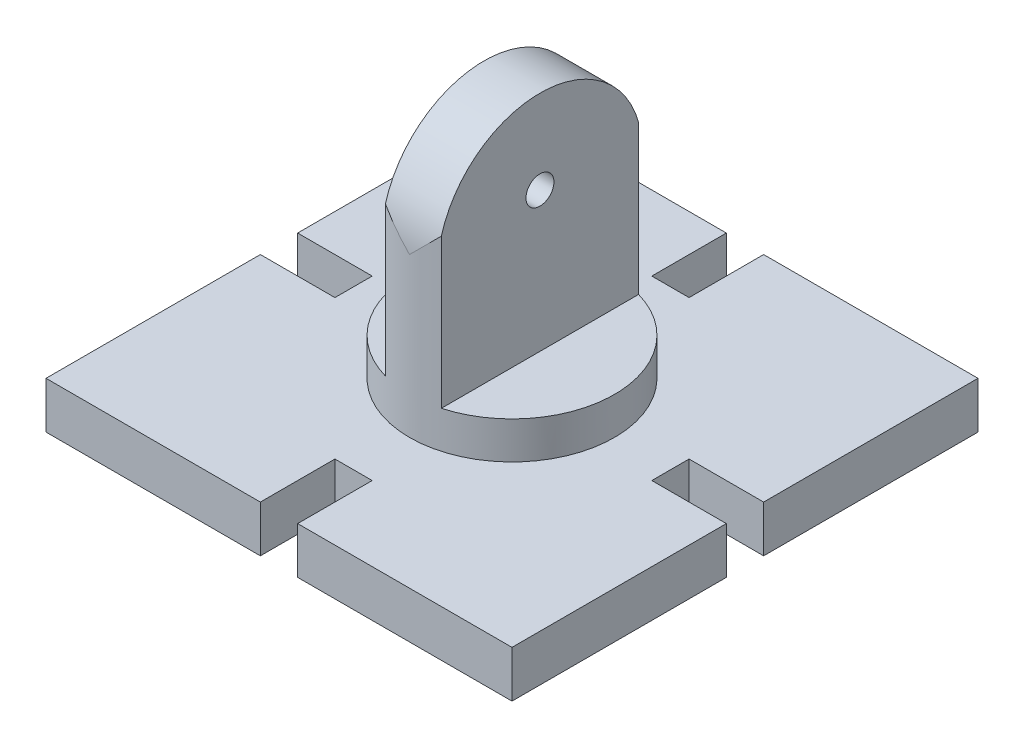
from build123d import *

# Parameters (mm, degrees)
SKETCH1_W           = 25
SKETCH1_H           = 25
BOSS_EXTRUDE1_DEPTH = 2.5
SKETCH2_R           = 5.5
BOSS_EXTRUDE2_DEPTH = 2
BOSS_EXTRUDE3_DEPTH = 12
CUT_EXTRUDE1_DEPTH  = 15
SKETCH6_W           = 2
SKETCH6_H           = 8
SKETCH6_W_2         = 8
SKETCH6_H_2         = 2
CUT_EXTRUDE2_DEPTH  = 15
SKETCH7_R           = 0.75
CUT_EXTRUDE3_DEPTH  = 10


with BuildPart() as part:
    # Sketch1 → Boss-Extrude1 (new body)
    with BuildSketch(Plane(origin=(0, 0, 0), x_dir=(1, 0, 0), z_dir=(0, 1, 0))):
        Rectangle(SKETCH1_W, SKETCH1_H)
    extrude(amount=BOSS_EXTRUDE1_DEPTH)

    # Sketch2 → Boss-Extrude2 (add)
    with BuildSketch(Plane(origin=(0, 2.5, 0), x_dir=(1, 0, 0), z_dir=(0, 1, 0))):
        Circle(SKETCH2_R)
    extrude(amount=BOSS_EXTRUDE2_DEPTH)

    # Sketch3 → Boss-Extrude3 (add)
    with BuildSketch(Plane(origin=(0, 4.5, 0), x_dir=(1, 0, 0), z_dir=(0, 1, 0))):
        with BuildLine():
            ThreePointArc((1.5, 5.291502622), (0, 5.5), (-1.5, 5.291502622))
            Line((-1.5, 5.291502622), (-1.5, -5.291502622))
            ThreePointArc((-1.5, -5.291502622), (0, -5.5), (1.5, -5.291502622))
            Line((1.5, -5.291502622), (1.5, 5.291502622))
        make_face()
    extrude(amount=BOSS_EXTRUDE3_DEPTH)

    # Sketch4 → Cut-Extrude1 (cut)
    with BuildSketch(Plane(origin=(1.5, 0, 0), x_dir=(0, 0, -1), z_dir=(1, 0, 0))):
        with BuildLine():
            Line((-5.5, 17.101407095), (-5.5, 11))
            ThreePointArc((-5.5, 11), (0, 16.5), (5.5, 11))
            Line((5.5, 11), (5.5, 17.101407095))
            Line((5.5, 17.101407095), (-5.5, 17.101407095))
        make_face()
    extrude(amount=-CUT_EXTRUDE1_DEPTH, mode=Mode.SUBTRACT)

    # Sketch6 → Cut-Extrude2 (cut)
    with BuildSketch(Plane(origin=(0, 2.5, 0), x_dir=(1, 0, 0), z_dir=(0, 1, 0))):
        with Locations((0, 12.5)):
            Rectangle(SKETCH6_W, SKETCH6_H)
        with Locations((0, -12.5)):
            Rectangle(SKETCH6_W, SKETCH6_H)
        with Locations((12.5, 0)):
            Rectangle(SKETCH6_W_2, SKETCH6_H_2)
        with Locations((-12.5, 0)):
            Rectangle(SKETCH6_W_2, SKETCH6_H_2)
    extrude(amount=-CUT_EXTRUDE2_DEPTH, mode=Mode.SUBTRACT)

    # Sketch7 → Cut-Extrude3 (cut)
    with BuildSketch(Plane(origin=(1.5, 0, 0), x_dir=(0, 0, -1), z_dir=(1, 0, 0))):
        with Locations((0, 12)):
            Circle(SKETCH7_R)
    extrude(amount=-CUT_EXTRUDE3_DEPTH, mode=Mode.SUBTRACT)


solid = part.part
